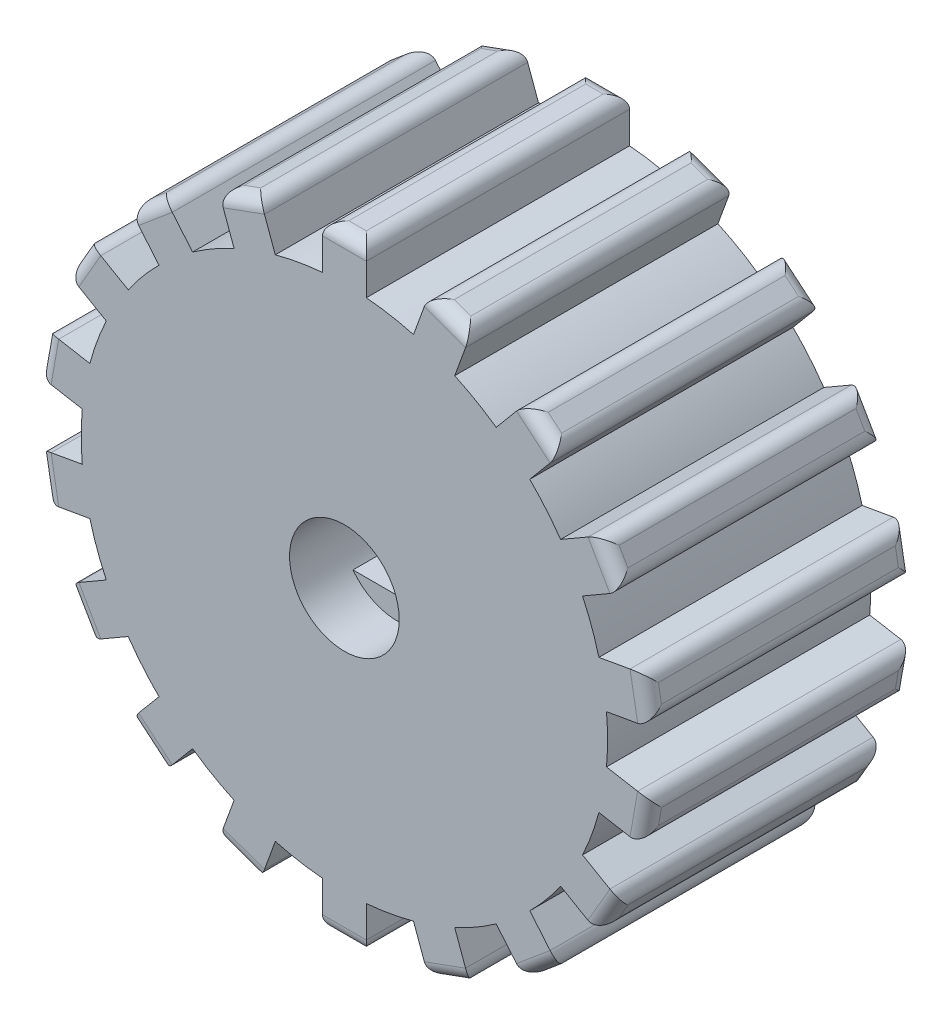
from build123d import *
from build123d.topology import SkipClean

# Parameters (mm, degrees)
SKETCH2_R                = 60
BOSS_EXTRUDE1_DEPTH      = 60
SKETCH3_W                = 10
SKETCH3_H                = 10.47851478
BOSS_EXTRUDE2_DEPTH      = 60
FILLET2_R                = 3
CIRPATTERN1_COUNT        = 18
FILLET2_OF_CIRPATTERN1_R = 3
SKETCH4_R                = 10
CUT_EXTRUDE1_DEPTH       = 60
SKETCH5_R                = 22.481820488
BOSS_EXTRUDE3_DEPTH      = 60
SKETCH6_R                = 12.5
CUT_EXTRUDE2_DEPTH       = 12
CUT_EXTRUDE3_DEPTH       = 30.5


with BuildPart() as part:
    # Sketch2 → Boss-Extrude1 (new body)
    with BuildSketch(Plane.XY):
        Circle(SKETCH2_R)
    extrude(amount=BOSS_EXTRUDE1_DEPTH)

    # Sketch3 → Boss-Extrude2 (add)
    with BuildSketch(Plane.XY.offset(60)):
        with Locations((0, 64.76074261)):
            Rectangle(SKETCH3_W, SKETCH3_H)
    boss_extrude2 = extrude(amount=-BOSS_EXTRUDE2_DEPTH)

    # Fillet2
    fillet2_edges = [part.edges().sort_by_distance(p)[0] for p in [
        (5, 70, 30),
        (0, 70, 0),
        (-5, 70, 30),
        (0, 70, 60),
    ]]
    fillet(fillet2_edges, radius=FILLET2_R)

    # CirPattern1: Boss-Extrude2 ×18 about axis
    cirpattern1_axis = Axis((0, 0, 0), (0, 0, 1))
    for i in range(1, CIRPATTERN1_COUNT):
        add(boss_extrude2.rotate(cirpattern1_axis, i * 360 / CIRPATTERN1_COUNT))

    # Fillet2 of CirPattern1
    fillet2_of_cirpattern1_edges = [part.edges().sort_by_distance(p)[0] for p in [
        (-19.242946929, 67.488584172, 30),
        (-23.941410033, 65.778483455, 0),
        (-28.639873137, 64.068382738, 30),
        (-23.941410033, 65.778483455, 60),
        (-41.164910462, 56.837049067, 30),
        (-44.995132678, 53.623111018, 0),
        (-48.825354894, 50.40917297, 30),
        (-44.995132678, 53.623111018, 60),
        (-58.121778265, 39.330127019, 30),
        (-60.621778265, 35, 0),
        (-63.121778265, 30.669872981, 30),
        (-60.621778265, 35, 60),
        (-68.068301823, 17.079411202, 30),
        (-68.936542711, 12.155372437, 0),
        (-69.804783599, 7.231333672, 30),
        (-68.936542711, 12.155372437, 60),
        (-69.804783599, -7.231333672, 30),
        (-68.936542711, -12.155372437, 0),
        (-68.068301823, -17.079411202, 30),
        (-68.936542711, -12.155372437, 60),
        (-63.121778265, -30.669872981, 30),
        (-60.621778265, -35, 0),
        (-58.121778265, -39.330127019, 30),
        (-60.621778265, -35, 60),
        (-48.825354894, -50.40917297, 30),
        (-44.995132678, -53.623111018, 0),
        (-41.164910462, -56.837049067, 30),
        (-44.995132678, -53.623111018, 60),
        (-28.639873137, -64.068382738, 30),
        (-23.941410033, -65.778483455, 0),
        (-19.242946929, -67.488584172, 30),
        (-23.941410033, -65.778483455, 60),
        (-5, -70, 30),
        (0, -70, 0),
        (5, -70, 30),
        (0, -70, 60),
        (19.242946929, -67.488584172, 30),
        (23.941410033, -65.778483455, 0),
        (28.639873137, -64.068382738, 30),
        (23.941410033, -65.778483455, 60),
        (41.164910462, -56.837049067, 30),
        (44.995132678, -53.623111018, 0),
        (48.825354894, -50.40917297, 30),
        (44.995132678, -53.623111018, 60),
        (58.121778265, -39.330127019, 30),
        (60.621778265, -35, 0),
        (63.121778265, -30.669872981, 30),
        (60.621778265, -35, 60),
        (68.068301823, -17.079411202, 30),
        (68.936542711, -12.155372437, 0),
        (69.804783599, -7.231333672, 30),
        (68.936542711, -12.155372437, 60),
        (69.804783599, 7.231333672, 30),
        (68.936542711, 12.155372437, 0),
        (68.068301823, 17.079411202, 30),
        (68.936542711, 12.155372437, 60),
        (63.121778265, 30.669872981, 30),
        (60.621778265, 35, 0),
        (58.121778265, 39.330127019, 30),
        (60.621778265, 35, 60),
        (48.825354894, 50.40917297, 30),
        (44.995132678, 53.623111018, 0),
        (41.164910462, 56.837049067, 30),
        (44.995132678, 53.623111018, 60),
        (28.639873137, 64.068382738, 30),
        (23.941410033, 65.778483455, 0),
        (19.242946929, 67.488584172, 30),
        (23.941410033, 65.778483455, 60),
    ]]
    fillet(fillet2_of_cirpattern1_edges, radius=FILLET2_OF_CIRPATTERN1_R)

    # Sketch4 → Cut-Extrude1 (cut)
    with BuildSketch(Plane.XY.offset(60)):
        Circle(SKETCH4_R)
    extrude(amount=-CUT_EXTRUDE1_DEPTH, mode=Mode.SUBTRACT)

    # Sketch5 → Boss-Extrude3 (add)
    with BuildSketch(Plane.XY.offset(60)):
        Circle(SKETCH5_R)
    extrude(amount=-BOSS_EXTRUDE3_DEPTH)

    # Sketch6 → Cut-Extrude2 (cut)
    with BuildSketch(Plane.XY.offset(60)):
        Circle(SKETCH6_R)
    extrude(amount=-CUT_EXTRUDE2_DEPTH, mode=Mode.SUBTRACT)

    # Sketch7 → Cut-Extrude3 (cut)
    with SkipClean():  # the faces are left unmerged after this step: merging them gives an invalid solid
        with BuildSketch(Plane.XY.offset(48)):
            with BuildLine():
                Line((10.037305415, -7.45), (-10.037305415, -7.45))
                ThreePointArc((-10.037305415, -7.45), (-12.5, 0), (-10.037305415, 7.45))
                Line((-10.037305415, 7.45), (10.037305415, 7.45))
                ThreePointArc((10.037305415, 7.45), (12.5, 0), (10.037305415, -7.45))
            make_face()
        extrude(amount=-CUT_EXTRUDE3_DEPTH, mode=Mode.SUBTRACT)


solid = part.part
